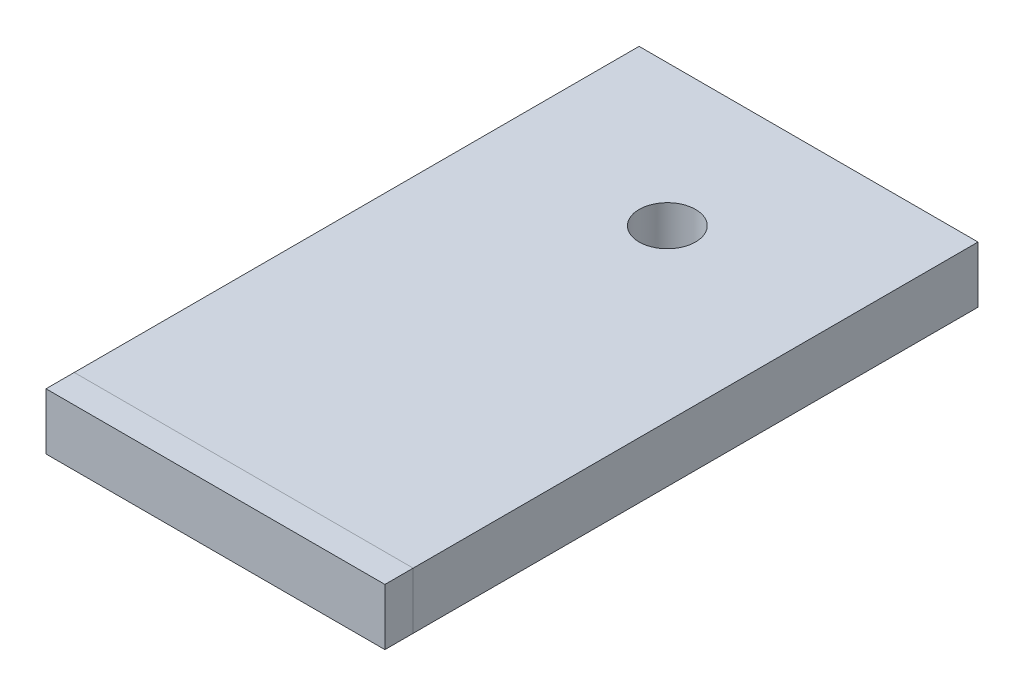
from build123d import *

# Parameters (mm, degrees)
SKETCH1_W           = 76.2
SKETCH1_H           = 127
BOSS_EXTRUDE1_DEPTH = 19.05
SKETCH2_R           = 6.35
CUT_EXTRUDE1_DEPTH  = 77.464125575
SKETCH3_W           = 76.2
SKETCH3_H           = 19.05
BOSS_EXTRUDE2_DEPTH = 6.35
SKETCH4_W           = 33.734375
SKETCH4_H           = 6.35
CUT_EXTRUDE2_DEPTH  = 140.9883388
SKETCH5_W           = 8.73125
SKETCH5_H           = 6.35
CUT_EXTRUDE3_DEPTH  = 6.35


with BuildPart() as part:
    # Sketch1 → Boss-Extrude1 (new body)
    with BuildSketch(Plane(origin=(0, 0, 0), x_dir=(1, 0, 0), z_dir=(0, 1, 0))):
        Rectangle(SKETCH1_W, SKETCH1_H)
    extrude(amount=BOSS_EXTRUDE1_DEPTH)

    # Sketch2 → Cut-Extrude1 (cut, through all)
    with BuildSketch(Plane(origin=(0, 19.05, 0), x_dir=(1, 0, 0), z_dir=(0, 1, 0))):
        with Locations(Location((0, 31.75, 0), (0, 0, 270))):
            Circle(SKETCH2_R)
    extrude(amount=-CUT_EXTRUDE1_DEPTH, mode=Mode.SUBTRACT)


with BuildPart() as body_2:
    # Sketch3 → Boss-Extrude2 (new body)
    with BuildSketch(Plane.XY.offset(63.5)):
        with Locations((0, 9.525)):
            Rectangle(SKETCH3_W, SKETCH3_H)
    extrude(amount=BOSS_EXTRUDE2_DEPTH)


with BuildPart() as cut_extrude2_tool:
    # Sketch4 → Cut-Extrude2 (new, through all)
    with BuildSketch(Plane(origin=(0, 0, -63.5), x_dir=(-1, 0, 0), z_dir=(0, 0, -1))):
        with Locations((-21.2328125, 3.175)):
            Rectangle(SKETCH4_W, SKETCH4_H)
        with Locations((21.2328125, 3.175)):
            Rectangle(SKETCH4_W, SKETCH4_H)
    extrude(amount=-CUT_EXTRUDE2_DEPTH)


with BuildPart() as part_1:
    add(part.part)

    # Cut-Extrude2: cut by cut_extrude2_tool
    add(cut_extrude2_tool.part, mode=Mode.SUBTRACT)


with BuildPart() as body_2_1:
    add(body_2.part)

    # Cut-Extrude2: cut by cut_extrude2_tool
    add(cut_extrude2_tool.part, mode=Mode.SUBTRACT)

    # Sketch5 → Cut-Extrude3 (cut)
    with BuildSketch(Plane.XY.offset(69.85)):
        with Locations((0, 3.175)):
            Rectangle(SKETCH5_W, SKETCH5_H)
    extrude(amount=-CUT_EXTRUDE3_DEPTH, mode=Mode.SUBTRACT)


solid = Compound([part_1.part, body_2_1.part])
